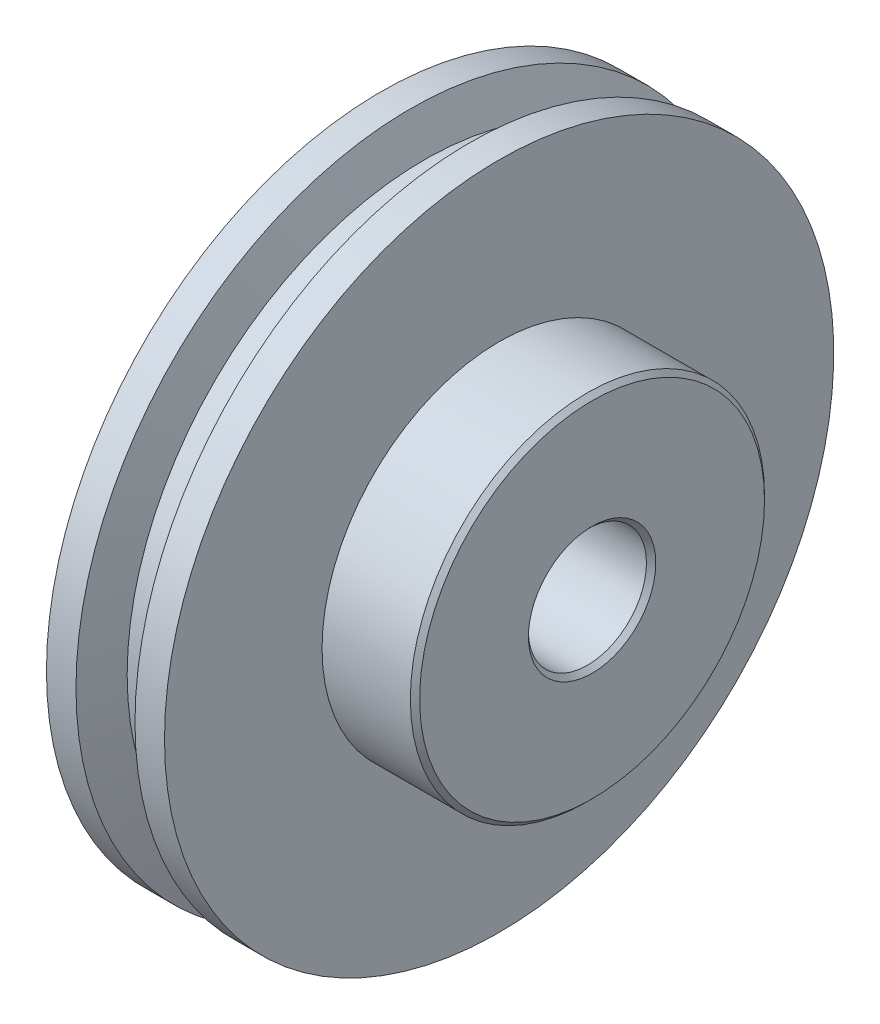
from build123d import *

# Parameters (mm, degrees)
SKETCH3_R           = 9.525
BOSS_EXTRUDE1_DEPTH = 5
SKETCH4_R           = 3.175
CUT_EXTRUDE1_DEPTH  = 28.871535659
CHAMFER1_SIZE       = 0.25


with BuildPart() as part:
    # Sketch2 → Revolve1 (revolve)
    with BuildSketch(Plane.XY, mode=Mode.PRIVATE) as revolve1_sk:
        Polygon((-3.175, 3.175), (3.175, 3.175), (3.175, 18), (1.5875, 18), (0.833641219, 16), (-0.833641219, 16), (-1.5875, 18), (-3.175, 18), align=None)
    revolve(revolve1_sk.sketch.rotate(Axis((0, 0, 0), (1, 0, 0)), 90), axis=Axis((0, 0, 0), (1, 0, 0)))

    # Sketch3 → Boss-Extrude1 (add)
    with BuildSketch(Plane(origin=(3.175, 0, 0), x_dir=(0, 0, -1), z_dir=(1, 0, 0))):
        with Locations(Location((0, 0, 0), (0, 0, 180))):
            Circle(SKETCH3_R)
    extrude(amount=BOSS_EXTRUDE1_DEPTH)

    # Sketch4 → Cut-Extrude1 (cut, through all)
    with BuildSketch(Plane(origin=(8.175, 0, 0), x_dir=(0, 0, -1), z_dir=(1, 0, 0))):
        with Locations(Location((0, 0, 0), (0, 0, 180))):
            Circle(SKETCH4_R)
    extrude(amount=-CUT_EXTRUDE1_DEPTH, mode=Mode.SUBTRACT)

    # Chamfer1
    chamfer1_edges = [part.edges().sort_by_distance(p)[0] for p in [
        (8.175, 0, -9.525),
        (8.175, 0, -3.175),
        (-3.175, 0, -3.175),
    ]]
    chamfer(chamfer1_edges, length=CHAMFER1_SIZE)


solid = part.part
